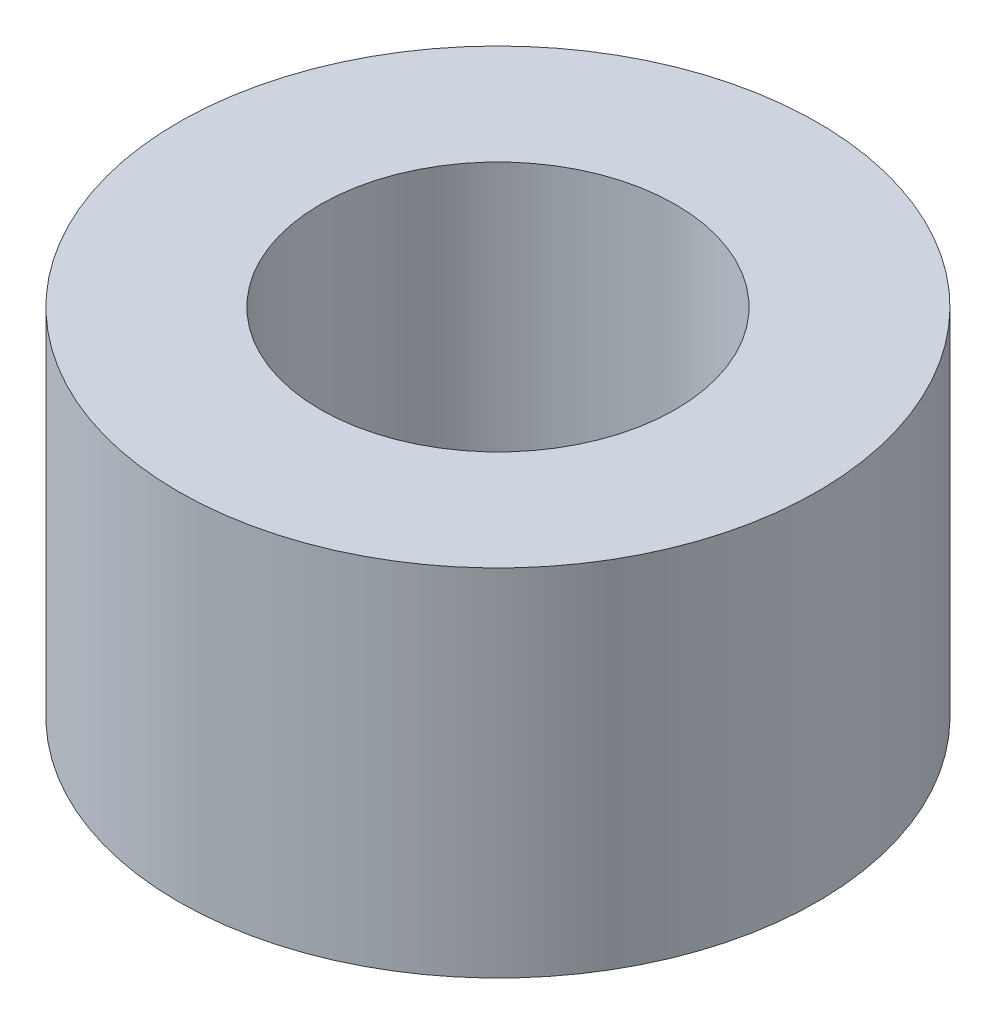
from build123d import *

# Parameters (mm, degrees)
SKETCH1_W = 2
SKETCH1_H = 5


with BuildPart() as part:
    # Sketch1 → Revolve1 (revolve)
    with BuildSketch(Plane.XY, mode=Mode.PRIVATE) as revolve1_sk:
        with Locations((-3.5, 0)):
            Rectangle(SKETCH1_W, SKETCH1_H)
    revolve(revolve1_sk.sketch.rotate(Axis((0, 9.409090909, 0), (0, -1, 0)), 270), axis=Axis((0, 9.409090909, 0), (0, -1, 0)))


solid = part.part
